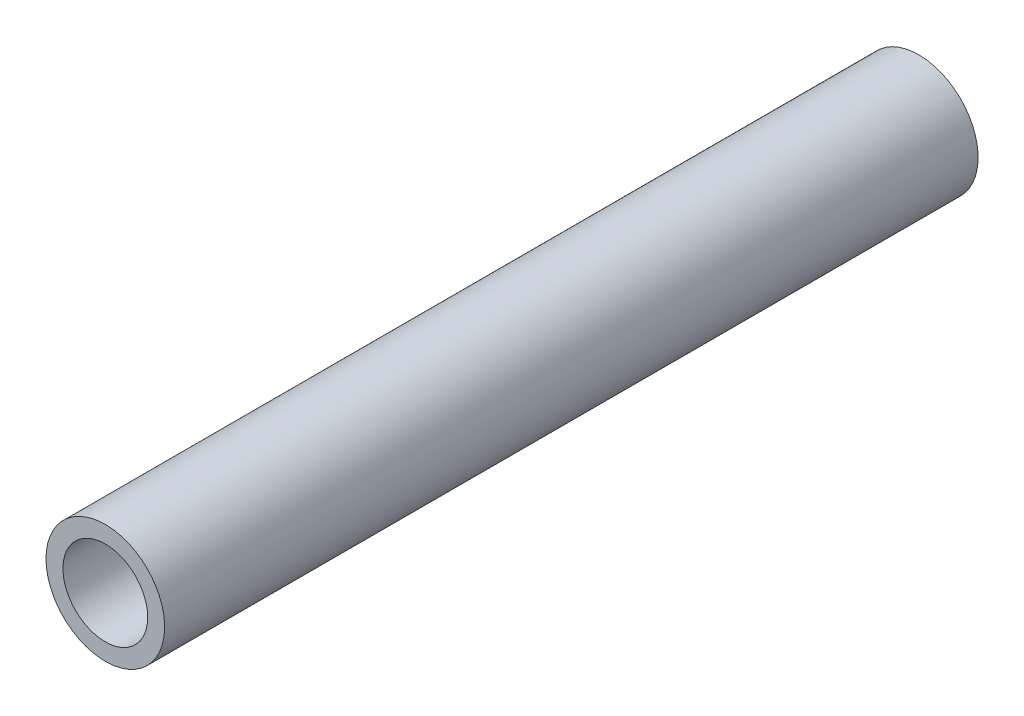
from build123d import *

# Parameters (mm, degrees)
SKETCH2_R           = 8.89
BOSS_EXTRUDE1_DEPTH = 121.92
SKETCH3_R           = 6.35
CUT_EXTRUDE1_DEPTH  = 123.566515003


with BuildPart() as part:
    # Sketch2 → Boss-Extrude1 (new body)
    with BuildSketch(Plane.XY):
        with Locations(Location((0, 0, 0), (0, 0, 180))):
            Circle(SKETCH2_R)
    extrude(amount=BOSS_EXTRUDE1_DEPTH)

    # Sketch3 → Cut-Extrude1 (cut, through all)
    with BuildSketch(Plane.XY.offset(121.92)):
        Circle(SKETCH3_R)
    extrude(amount=-CUT_EXTRUDE1_DEPTH, mode=Mode.SUBTRACT)


solid = part.part
